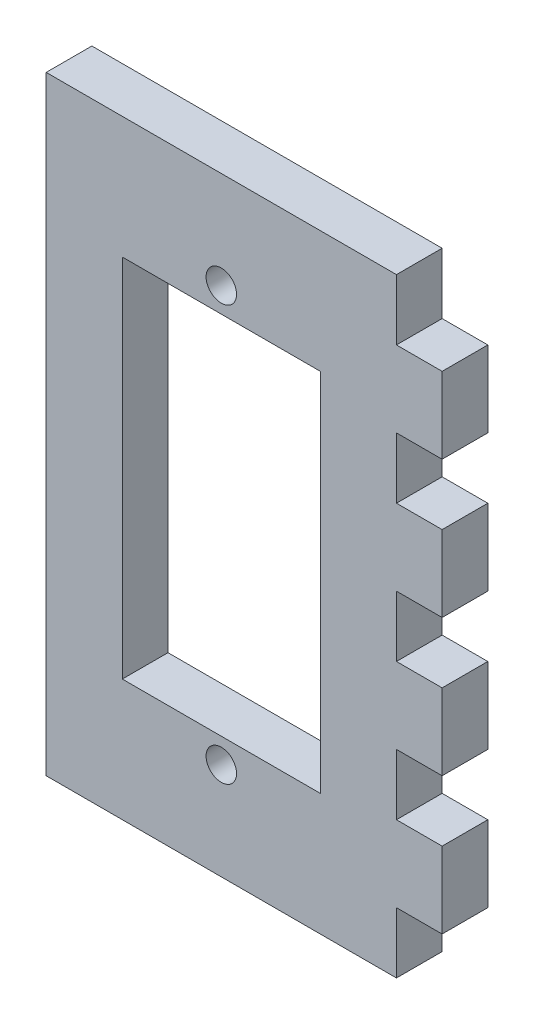
from build123d import *

# Parameters (mm, degrees)
SKETCH1_R           = 1
SKETCH1_W           = 13
SKETCH1_H           = 24
BOSS_EXTRUDE1_DEPTH = 3


with BuildPart() as part:
    # Sketch1 → Boss-Extrude1 (new body)
    with BuildSketch(Plane.XY):
        Polygon((11.5, 16), (14.5, 16), (14.5, 11), (11.5, 11), (11.5, 7), (14.5, 7), (14.5, 2), (11.5, 2), (11.5, -2), (14.5, -2), (14.5, -7), (11.5, -7), (11.5, -11), (14.5, -11), (14.5, -16), (11.5, -16), (11.5, -20), (-11.5, -20), (-11.5, 20), (11.5, 20), align=None)
        with Locations((0, 13.625)):
            Circle(SKETCH1_R, mode=Mode.SUBTRACT)
        with Locations(Location((0, -13.625, 0), (0, 0, 180))):
            Circle(SKETCH1_R, mode=Mode.SUBTRACT)
        Rectangle(SKETCH1_W, SKETCH1_H, mode=Mode.SUBTRACT)
    extrude(amount=BOSS_EXTRUDE1_DEPTH)


solid = part.part
